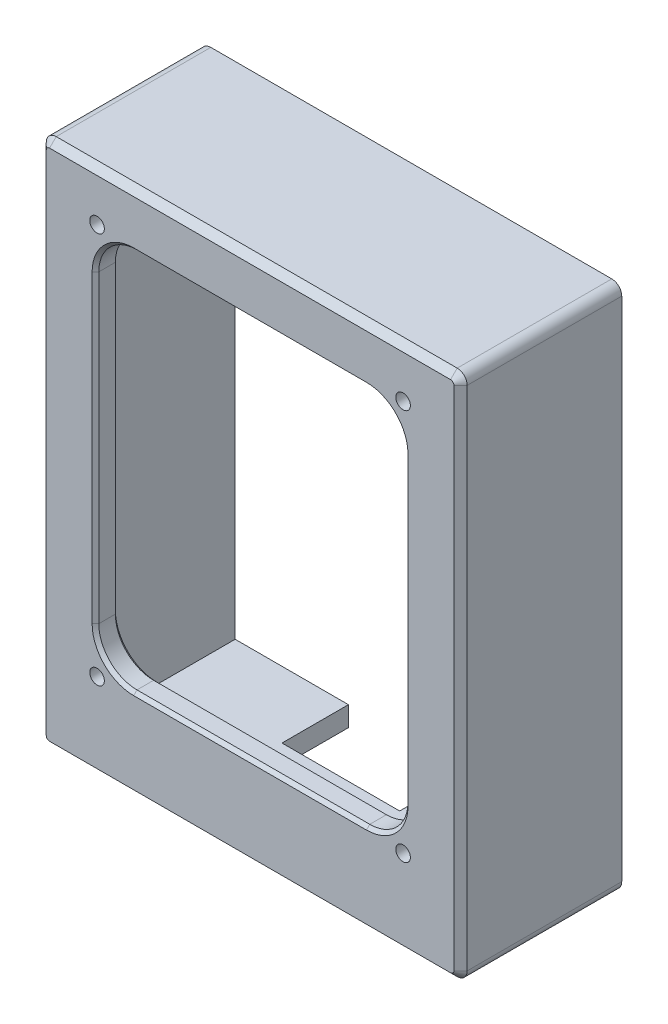
from build123d import *

# Parameters (mm, degrees)
SKETCH1_R           = 1.1
BOSS_EXTRUDE1_DEPTH = 3.5
BOSS_EXTRUDE2_START = 20.759
SKETCH2_R           = 1.25
SKETCH2_W           = 53
SKETCH2_H           = 71.3
BOSS_EXTRUDE2_DEPTH = 20.759
SKETCH3_R           = 6.499999954
SKETCH3_W           = 17.713
SKETCH3_H           = 10
CUT_EXTRUDE1_DEPTH  = 10
CHAMFER1_SIZE       = 1
CHAMFER2_SIZE       = 0.5
CHAMFER3_SIZE       = 1


with BuildPart() as part:
    # Sketch1 → Boss-Extrude1 (new body)
    with BuildSketch(Plane.XY):
        with BuildLine():
            Line((-8.645, -11.5), (-8.645, 64.8))
            ThreePointArc((-8.645, 64.8), (-8.205660172, 65.860660172), (-7.145, 66.3))
            Line((-7.145, 66.3), (53.195, 66.3))
            ThreePointArc((53.195, 66.3), (54.255660172, 65.860660172), (54.695, 64.8))
            Line((54.695, 64.8), (54.695, -11.5))
            ThreePointArc((54.695, -11.5), (54.255660172, -12.560660172), (53.195, -13))
            Line((53.195, -13), (-7.145, -13))
            ThreePointArc((-7.145, -13), (-8.205660172, -12.560660172), (-8.645, -11.5))
        make_face()
        Circle(SKETCH1_R, mode=Mode.SUBTRACT)
        with Locations((0, 58.9)):
            Circle(SKETCH1_R, mode=Mode.SUBTRACT)
        with Locations((46.05, 58.9)):
            Circle(SKETCH1_R, mode=Mode.SUBTRACT)
        with Locations((46.05, 0)):
            Circle(SKETCH1_R, mode=Mode.SUBTRACT)
        with BuildLine():
            Line((5.51, 0.775), (40.54, 0.775))
            ThreePointArc((40.54, 0.775), (44.605863992, 2.459136008), (46.29, 6.525))
            Line((46.29, 6.525), (46.29, 52.375))
            ThreePointArc((46.29, 52.375), (44.605863992, 56.440863992), (40.54, 58.125))
            Line((40.54, 58.125), (5.51, 58.125))
            ThreePointArc((5.51, 58.125), (1.444136008, 56.440863992), (-0.24, 52.375))
            Line((-0.24, 52.375), (-0.24, 6.525))
            ThreePointArc((-0.24, 6.525), (1.444136008, 2.459136008), (5.51, 0.775))
        make_face(mode=Mode.SUBTRACT)
    extrude(amount=BOSS_EXTRUDE1_DEPTH)

    # Sketch2 → Boss-Extrude2 (add)
    with BuildSketch(Plane(origin=(0, 0, 0), x_dir=(-1, 0, 0), z_dir=(0, 0, -1)).offset(BOSS_EXTRUDE2_START)):
        with BuildLine():
            Line((-54.695, -11.5), (-54.695, 64.8))
            ThreePointArc((-54.695, 64.8), (-54.255660172, 65.860660172), (-53.195, 66.3))
            Line((-53.195, 66.3), (7.145, 66.3))
            ThreePointArc((7.145, 66.3), (8.205660172, 65.860660172), (8.645, 64.8))
            Line((8.645, 64.8), (8.645, -11.5))
            ThreePointArc((8.645, -11.5), (8.205660172, -12.560660172), (7.145, -13))
            Line((7.145, -13), (-53.195, -13))
            ThreePointArc((-53.195, -13), (-54.255660172, -12.560660172), (-54.695, -11.5))
        make_face()
        with Locations((-52.195, -10.5)):
            Circle(SKETCH2_R, mode=Mode.SUBTRACT)
        with Locations((6.145, -10.5)):
            Circle(SKETCH2_R, mode=Mode.SUBTRACT)
        with Locations((6.145, 63.8)):
            Circle(SKETCH2_R, mode=Mode.SUBTRACT)
        with Locations((-52.195, 63.8)):
            Circle(SKETCH2_R, mode=Mode.SUBTRACT)
        with Locations((-23.025, 26.65)):
            Rectangle(SKETCH2_W, SKETCH2_H, mode=Mode.SUBTRACT)
    extrude(amount=-BOSS_EXTRUDE2_DEPTH)

    # Sketch3 → Cut-Extrude1 (cut)
    with BuildSketch(Plane.XZ.offset(13)):
        with Locations((38.695, -24.759)):
            Circle(SKETCH3_R)
        with Locations((22.424100803, -15.759)):
            Rectangle(SKETCH3_W, SKETCH3_H)
    extrude(amount=-CUT_EXTRUDE1_DEPTH, mode=Mode.SUBTRACT)

    # Chamfer1
    chamfer1_edges = [part.edges().sort_by_distance(p)[0] for p in [
        (54.255660172, -12.560660172, 3.5),
        (54.695, 26.65, 3.5),
        (54.255660172, 65.860660172, 3.5),
        (23.025, 66.3, 3.5),
        (-8.205660172, 65.860660172, 3.5),
        (-8.645, 26.65, 3.5),
        (-8.205660172, -12.560660172, 3.5),
        (23.025, -13, 3.5),
    ]]
    chamfer(chamfer1_edges, length=CHAMFER1_SIZE)

    # Chamfer2
    chamfer2_edges = [part.edges().sort_by_distance(p)[0] for p in [
        (44.605863992, 2.459136008, 0),
        (46.29, 29.45, 0),
        (44.605863992, 56.440863992, 0),
        (23.025, 58.125, 0),
        (1.444136008, 56.440863992, 0),
        (-0.24, 29.45, 0),
        (1.444136008, 2.459136008, 0),
        (23.025, 0.775, 0),
        (44.605863992, 2.459136008, 3.5),
        (46.29, 29.45, 3.5),
        (44.605863992, 56.440863992, 3.5),
        (23.025, 58.125, 3.5),
        (1.444136008, 56.440863992, 3.5),
        (-0.24, 29.45, 3.5),
        (1.444136008, 2.459136008, 3.5),
        (23.025, 0.775, 3.5),
    ]]
    chamfer(chamfer2_edges, length=CHAMFER2_SIZE)

    # Chamfer3
    chamfer3_edges = [part.edges().sort_by_distance(p)[0] for p in [
        (38.695, -13, -18.259000046),
        (13.567600803, -13, -15.759),
        (31.280600803, -13, -15.759),
        (22.424100803, -13, -10.759),
    ]]
    chamfer(chamfer3_edges, length=CHAMFER3_SIZE)


solid = part.part
